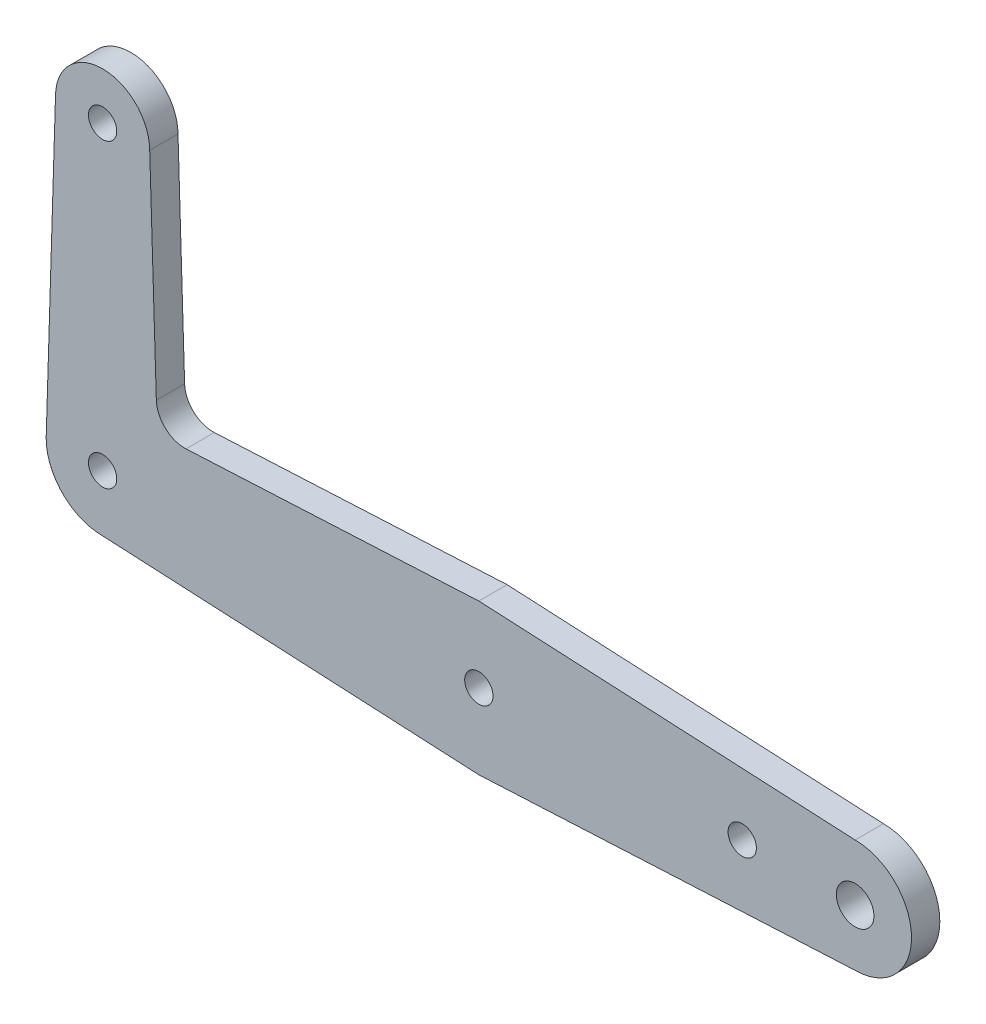
from build123d import *

# Parameters (mm, degrees)
BOSS_EXTRUDE1_DEPTH = 4.7752
FILLET1_R           = 4.7752
SKETCH2_R           = 2.3876
CUT_EXTRUDE1_DEPTH  = 151.645704088
SKETCH3_R           = 3.175
CUT_EXTRUDE2_DEPTH  = 4.7752


with BuildPart() as part:
    # Sketch1 → Boss-Extrude1 (new body)
    with BuildSketch(Plane.XY):
        with BuildLine():
            ThreePointArc((7.9502, 0), (0, 7.9502), (-7.9502, 0))
            Line((-7.9502, 0), (-9.506710526, -50.210016974))
            Line((-9.506710526, -50.210016974), (-9.525, -50.8))
            ThreePointArc((-9.525, -50.8), (-6.735192091, -57.535192091), (0, -60.325))
            Line((0, -60.325), (62.233167082, -63.436658354))
            Line((62.233167082, -63.436658354), (63.5, -63.5))
            Line((63.5, -63.5), (64.766832918, -63.436658354))
            Line((64.766832918, -63.436658354), (127, -60.325))
            ThreePointArc((127, -60.325), (136.525, -50.8), (127, -41.275))
            Line((127, -41.275), (64.766832918, -38.163341646))
            Line((64.766832918, -38.163341646), (63.5, -38.1))
            Line((63.5, -38.1), (62.233167082, -38.163341646))
            Line((62.233167082, -38.163341646), (9.215441066, -40.814227947))
            Line((9.215441066, -40.814227947), (7.9502, 0))
        make_face()
        with BuildLine():
            Line((9.525, -50.8), (9.506710526, -50.210016974))
            ThreePointArc((9.506710526, -50.210016974), (9.520426534, -50.504866777), (9.525, -50.8))
        make_face(mode=Mode.SUBTRACT)
    extrude(amount=BOSS_EXTRUDE1_DEPTH)

    # Fillet1
    fillet1_edges = [part.edges().sort_by_distance(p)[0] for p in [
        (9.215441066, -40.814227947, 2.3876),
    ]]
    fillet(fillet1_edges, radius=FILLET1_R)

    # Sketch2 → Cut-Extrude1 (cut, through all)
    with BuildSketch(Plane.XY.offset(4.7752)):
        Circle(SKETCH2_R)
        with Locations((0, -50.8)):
            Circle(SKETCH2_R)
        with Locations((63.5, -50.8)):
            Circle(SKETCH2_R)
        with Locations((107.95, -50.8)):
            Circle(SKETCH2_R)
    extrude(amount=-CUT_EXTRUDE1_DEPTH, mode=Mode.SUBTRACT)

    # Sketch3 → Cut-Extrude2 (cut)
    with BuildSketch(Plane.XY.offset(4.7752)):
        with Locations((127, -50.8)):
            Circle(SKETCH3_R)
    extrude(amount=-CUT_EXTRUDE2_DEPTH, mode=Mode.SUBTRACT)


solid = part.part
